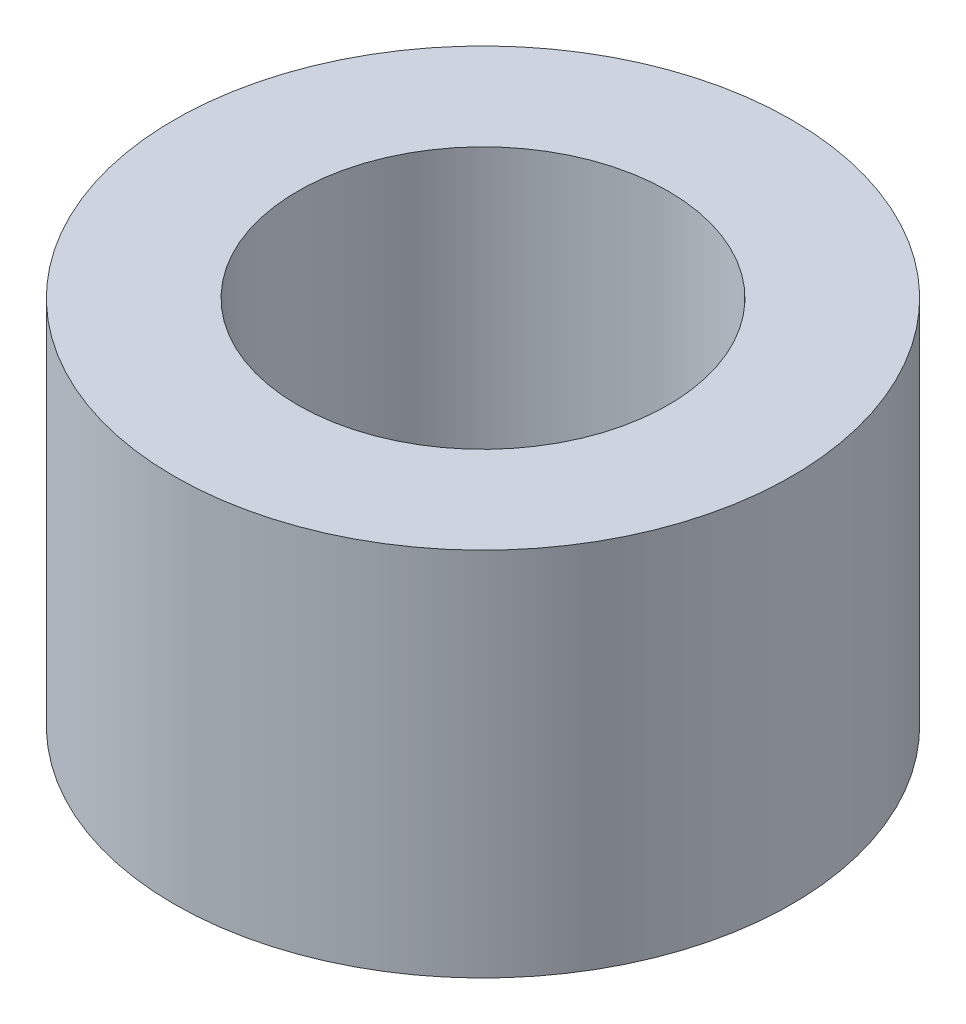
from build123d import *

# Parameters (mm, degrees)
SKETCH_1_R      = 2.5
SKETCH_1_R_2    = 1.5
EXTRUDE_1_DEPTH = 3


with BuildPart() as part:
    # Эскиз1 → Бобышка-Вытянуть1 (new body)
    with BuildSketch(Plane(origin=(0, 0, 0), x_dir=(1, 0, 0), z_dir=(0, 1, 0))):
        with Locations(Location((0, 0, 0), (0, 0, 270))):
            Circle(SKETCH_1_R)
        with Locations(Location((0, 0, 0), (0, 0, 270))):
            Circle(SKETCH_1_R_2, mode=Mode.SUBTRACT)
    extrude(amount=EXTRUDE_1_DEPTH)


solid = part.part
